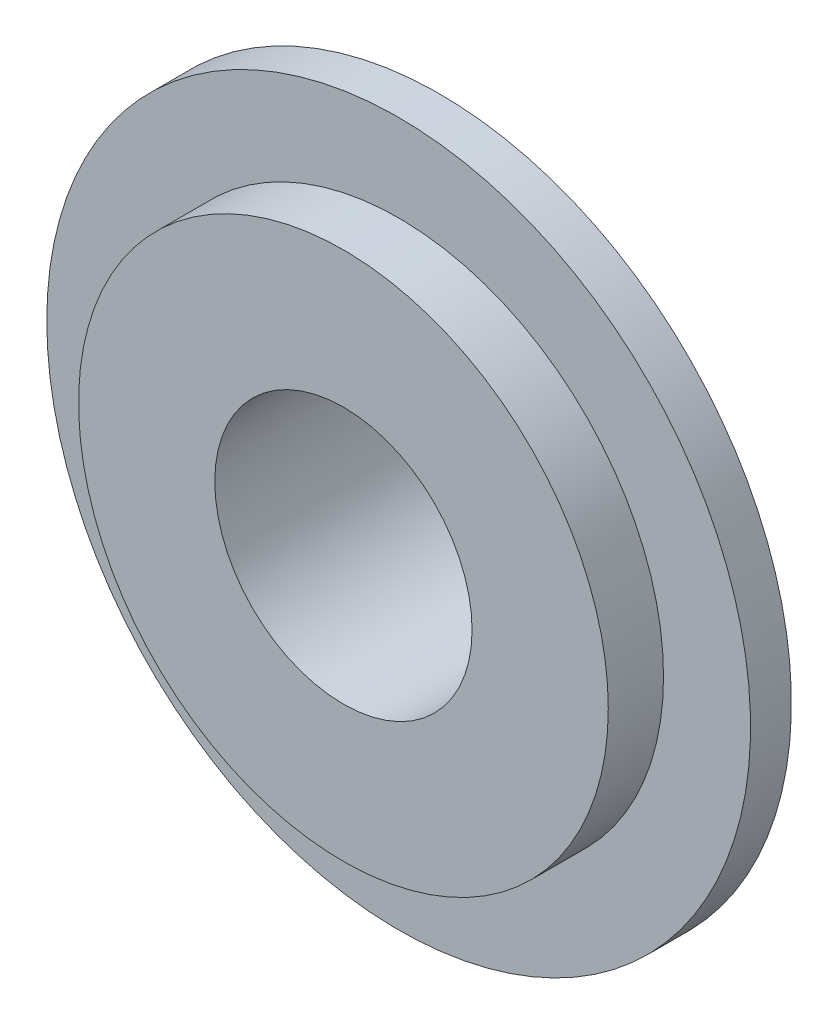
from build123d import *

# Parameters (mm, degrees)
SKETCH1_R           = 17.5
SKETCH1_R_2         = 8.5
BOSS_EXTRUDE1_DEPTH = 5
SKETCH2_R           = 23.25
SKETCH2_R_2         = 17.5
BOSS_EXTRUDE2_DEPTH = 1.35
BOSS_EXTRUDE3_START = 2.7
SKETCH3_R           = 11.586953436
SKETCH3_R_2         = 8.5
BOSS_EXTRUDE3_DEPTH = 2.7


with BuildPart() as part:
    # Sketch1 → Boss-Extrude1 (new, symmetric)
    with BuildSketch(Plane.XY):
        Circle(SKETCH1_R)
        Circle(SKETCH1_R_2, mode=Mode.SUBTRACT)
    extrude(amount=BOSS_EXTRUDE1_DEPTH, both=True)

    # Sketch2 → Boss-Extrude2 (add, symmetric)
    with BuildSketch(Plane.XY):
        with Locations(Location((0, 0, 0), (0, 0, 180))):
            Circle(SKETCH2_R)
        Circle(SKETCH2_R_2, mode=Mode.SUBTRACT)
    extrude(amount=BOSS_EXTRUDE2_DEPTH, both=True)

    # Sketch3 → Boss-Extrude3 (add)
    with BuildSketch(Plane(origin=(0, 0, -5), x_dir=(-1, 0, 0), z_dir=(0, 0, -1)).offset(BOSS_EXTRUDE3_START)):
        with Locations(Location((0, 0, 0), (0, 0, 180))):
            Circle(SKETCH3_R)
        Circle(SKETCH3_R_2, mode=Mode.SUBTRACT)
    extrude(amount=-BOSS_EXTRUDE3_DEPTH)


solid = part.part
